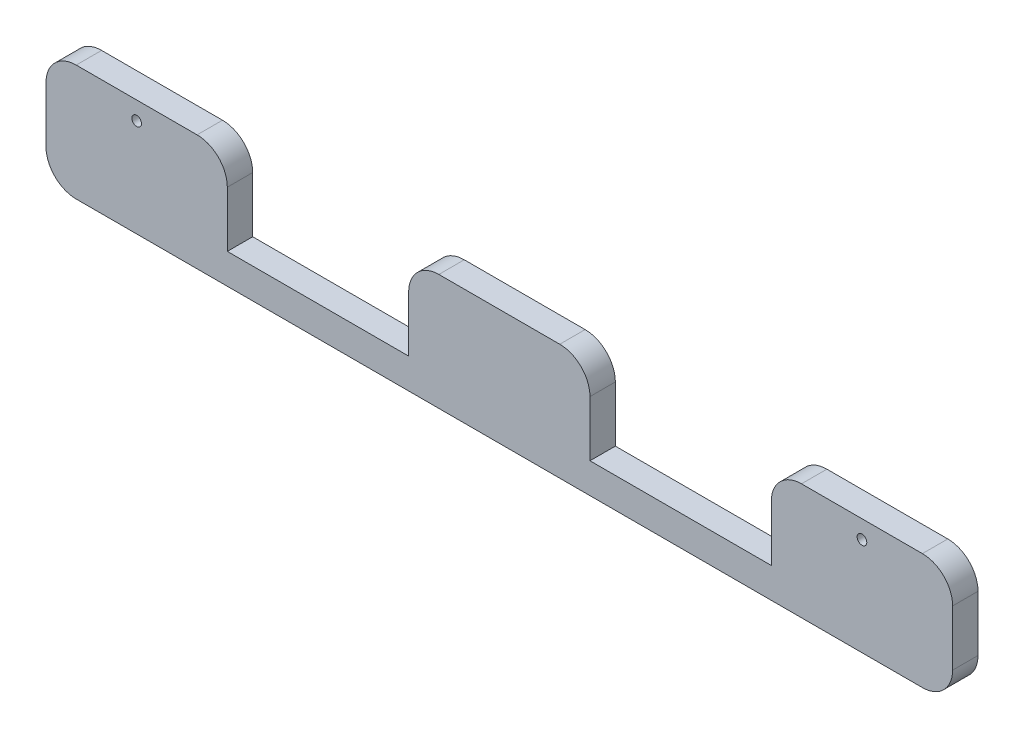
from build123d import *

# Parameters (mm, degrees)
SKETCH1_W           = 190.5
SKETCH1_H           = 24.384
BOSS_EXTRUDE1_DEPTH = 5.334
SKETCH3_W           = 38.1
SKETCH3_H           = 18.034
CUT_EXTRUDE1_DEPTH  = 122.162721385
SKETCH4_R           = 1.016
CUT_EXTRUDE2_DEPTH  = 122.162721385
FILLET1_R           = 6.35


with BuildPart() as part:
    # Sketch1 → Boss-Extrude1 (new body)
    with BuildSketch(Plane.XY):
        with Locations((10.187554582, -47.262819662)):
            Rectangle(SKETCH1_W, SKETCH1_H)
    extrude(amount=BOSS_EXTRUDE1_DEPTH)

    # Sketch3 → Cut-Extrude1 (cut, through all)
    with BuildSketch(Plane.XY.offset(5.334)):
        with Locations((-27.912445418, -44.087819662)):
            Rectangle(SKETCH3_W, SKETCH3_H)
        with Locations((48.287554582, -44.087819662)):
            Rectangle(SKETCH3_W, SKETCH3_H)
    extrude(amount=-CUT_EXTRUDE1_DEPTH, mode=Mode.SUBTRACT)

    # Sketch4 → Cut-Extrude2 (cut, through all)
    with BuildSketch(Plane.XY.offset(5.334)):
        with Locations((-66.012445418, -38.880819662)):
            Circle(SKETCH4_R)
        with Locations(Location((86.387554582, -38.880819662, 0), (0, 0, 180))):
            Circle(SKETCH4_R)
    extrude(amount=-CUT_EXTRUDE2_DEPTH, mode=Mode.SUBTRACT)

    # Fillet1
    fillet1_edges = [part.edges().sort_by_distance(p)[0] for p in [
        (-46.962445418, -35.070819662, 2.667),
        (-8.862445418, -35.070819662, 2.667),
        (29.237554582, -35.070819662, 2.667),
        (67.337554582, -35.070819662, 2.667),
        (-85.062445418, -35.070819662, 2.667),
        (105.437554582, -35.070819662, 2.667),
        (105.437554582, -59.454819662, 2.667),
        (-85.062445418, -59.454819662, 2.667),
    ]]
    fillet(fillet1_edges, radius=FILLET1_R)


solid = part.part
